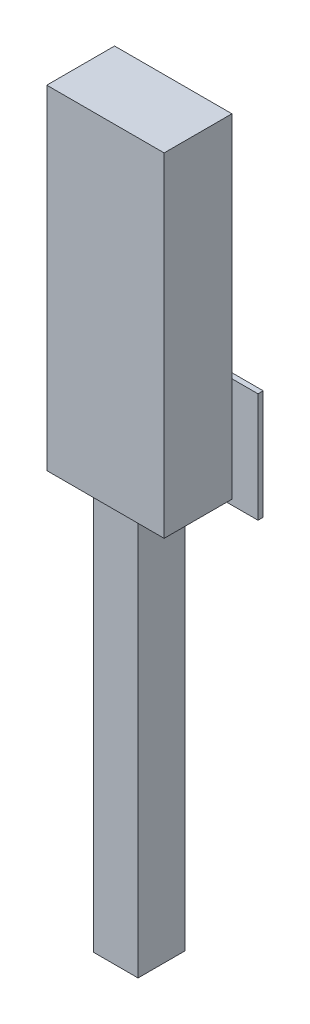
from build123d import *

# Parameters (mm, degrees)
REFLECTOR_START     = 44
SKETCH1_W           = 26
SKETCH1_H           = 128
REFLECTOR_DEPTH     = 45
CAVITY_START        = 47
SKETCH2_W           = 29
SKETCH2_H           = 122
CAVITY_DEPTH        = 39
R7S_LAMP_START      = 160
SKETCH3_R           = 5
R7S_LAMP_DEPTH      = 118
HEATER_COLUMN_START = 58
SKETCH4_W           = 18
SKETCH4_H           = 155
HEATER_COLUMN_DEPTH = 17
HEAT_SHIELD_START   = 30
SKETCH5_W           = 2
SKETCH5_H           = 42
HEAT_SHIELD_DEPTH   = 66


with BuildPart() as part:
    # Sketch1 → reflector (new body)
    with BuildSketch(Plane(origin=(0, 0, 0), x_dir=(0, 0, -1), z_dir=(1, 0, 0)).offset(REFLECTOR_START)):
        with Locations((-64, 219)):
            Rectangle(SKETCH1_W, SKETCH1_H)
    extrude(amount=REFLECTOR_DEPTH)


with BuildPart() as body_2:
    # Sketch2 → cavity (new body)
    with BuildSketch(Plane(origin=(0, 0, 0), x_dir=(0, 0, -1), z_dir=(1, 0, 0)).offset(CAVITY_START)):
        with Locations((-59.5, 219)):
            Rectangle(SKETCH2_W, SKETCH2_H)
    extrude(amount=CAVITY_DEPTH)


with BuildPart() as part_1:
    add(part.part)

    # Combine1: cut body 2
    add(body_2.part, mode=Mode.SUBTRACT)


with BuildPart() as body_2_2:
    # Sketch3 → r7s_lamp (new body)
    with BuildSketch(Plane(origin=(0, 0, 0), x_dir=(1, 0, 0), z_dir=(0, 1, 0)).offset(R7S_LAMP_START)):
        with Locations((66.34, -59.5)):
            Circle(SKETCH3_R)
    extrude(amount=R7S_LAMP_DEPTH)


with BuildPart() as body_3:
    # Sketch4 → heater_column (new body)
    with BuildSketch(Plane(origin=(0, 0, 0), x_dir=(0, 0, -1), z_dir=(1, 0, 0)).offset(HEATER_COLUMN_START)):
        with Locations((-64, 77.5)):
            Rectangle(SKETCH4_W, SKETCH4_H)
    extrude(amount=HEATER_COLUMN_DEPTH)


with BuildPart() as body_4:
    # Sketch5 → heat_shield (new body)
    with BuildSketch(Plane(origin=(0, 0, 0), x_dir=(0, 0, -1), z_dir=(1, 0, 0)).offset(HEAT_SHIELD_START)):
        with Locations((-47, 171)):
            Rectangle(SKETCH5_W, SKETCH5_H)
    extrude(amount=HEAT_SHIELD_DEPTH)


solid = Compound([part_1.part, body_2_2.part, body_3.part, body_4.part])
